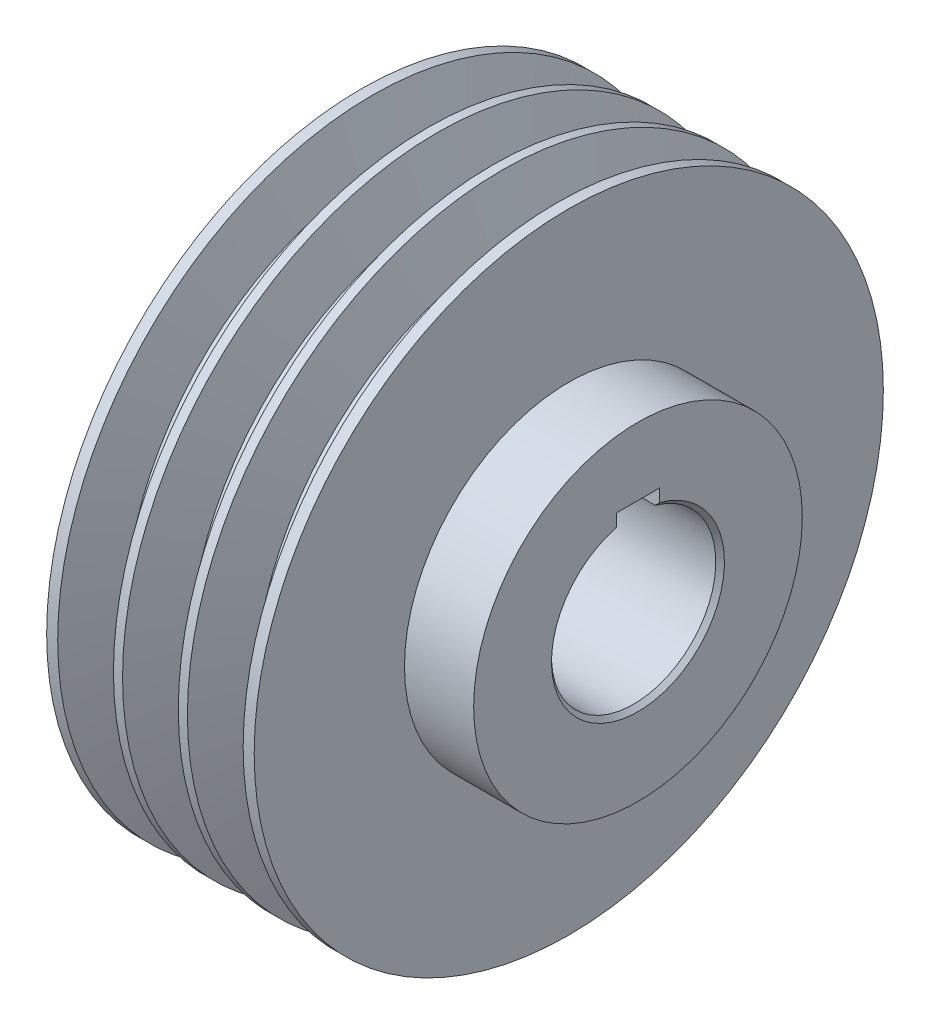
from build123d import *

# Parameters (mm, degrees)
PATTERN_LINEAR_1_COUNT = 3
PATTERN_LINEAR_1_PITCH = 15
CHAMFER_1_SIZE         = 1
SKETCH_4_W             = 10
SKETCH_4_H             = 3.969697172
CUT_EXTRUDE_1_DEPTH    = 122.165692339


with BuildPart() as part:
    # 草图1 → 旋转1 (revolve)
    with BuildSketch(Plane.XY, mode=Mode.PRIVATE) as revolve_1_sk:
        Polygon((0, 19), (0, 72.75), (48, 72.75), (48, 38), (64, 38), (64, 19), align=None)
    revolve(revolve_1_sk.sketch.rotate(Axis((0, 0, 0), (1, 0, 0)), 90), axis=Axis((0, 0, 0), (1, 0, 0)))

    # 草图2 → 切除-旋转1 (revolve, cut)
    with BuildSketch(Plane.XY, mode=Mode.PRIVATE) as cut_revolve_1_sk:
        Polygon((11.504349764, 61.3), (15.446900937, 72.75), (2.553099063, 72.75), (6.495650236, 61.3), align=None)
    cut_revolve_1 = revolve(cut_revolve_1_sk.sketch.rotate(Axis((0, 0, 0), (1, 0, 0)), 90), axis=Axis((0, 0, 0), (1, 0, 0)), mode=Mode.SUBTRACT)

    # 阵列(线性)1: 切除-旋转1 ×3
    with Locations(*[(i * PATTERN_LINEAR_1_PITCH, 0, 0) for i in range(1, PATTERN_LINEAR_1_COUNT)]):
        add(cut_revolve_1, mode=Mode.SUBTRACT)

    # 倒角1
    chamfer_1_edges = [part.edges().sort_by_distance(p)[0] for p in [
        (64, 0, -19),
        (0, 0, -19),
    ]]
    chamfer(chamfer_1_edges, length=CHAMFER_1_SIZE)

    # 草图4 → 切除-拉伸1 (cut, through all)
    with BuildSketch(Plane.ZY):
        with Locations((0, 20.315151366)):
            Rectangle(SKETCH_4_W, SKETCH_4_H)
    extrude(amount=-CUT_EXTRUDE_1_DEPTH, mode=Mode.SUBTRACT)


solid = part.part
